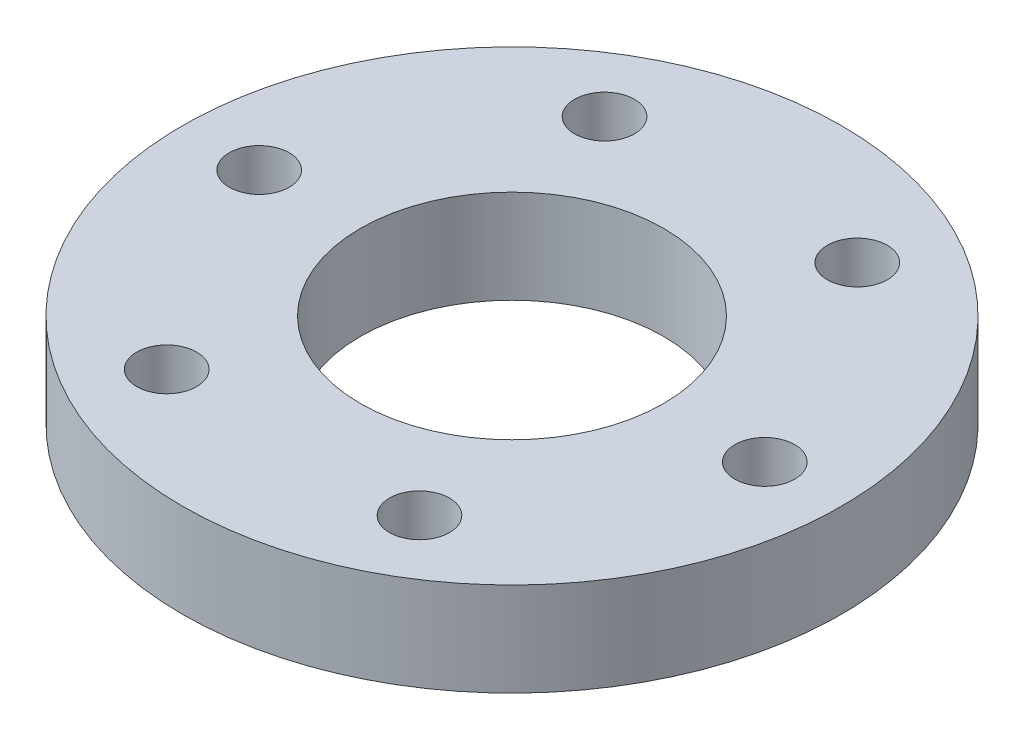
from build123d import *

# Parameters (mm, degrees)
SKETCH1_R            = 17.6
SKETCH1_R_2          = 8.1
BOSS_EXTRUDE1_DEPTH  = 5
CUT_EXTRUDE1_DEPTH   = 2.6
M3_CLEARANCE_HOLE1_D = 3.2
CIRPATTERN1_COUNT    = 6


with BuildPart() as part:
    # Sketch1 → Boss-Extrude1 (new body)
    with BuildSketch(Plane(origin=(0, 0, 0), x_dir=(1, 0, 0), z_dir=(0, 1, 0))):
        with Locations(Location((0, 0, 0), (0, 0, 270))):
            Circle(SKETCH1_R)
        with Locations(Location((0, 0, 0), (0, 0, 270))):
            Circle(SKETCH1_R_2, mode=Mode.SUBTRACT)
    extrude(amount=BOSS_EXTRUDE1_DEPTH)

    # Sketch2 → Cut-Extrude1 (cut)
    with BuildSketch(Plane.XZ):
        Polygon((13.5, 3.233161507), (10.7, 1.616580754), (10.7, -1.616580754), (13.5, -3.233161507), (16.3, -1.616580754), (16.3, 1.616580754), align=None)
    cut_extrude1 = extrude(amount=-CUT_EXTRUDE1_DEPTH, mode=Mode.SUBTRACT)

    # M3 Clearance Hole1 (through all)
    with Locations(Plane(origin=(0, 2.6, 0), x_dir=(-1, 0, 0), z_dir=(0, -1, 0))):
        with Locations((-13.5, 0)):
            m3_clearance_hole1 = Hole(M3_CLEARANCE_HOLE1_D / 2)

    # CirPattern1: Cut-Extrude1, M3 Clearance Hole1 ×6 about axis
    cirpattern1_axis = Axis((0, 0, 0), (0, 1, 0))
    add([cut_extrude1.rotate(cirpattern1_axis, i * 360 / CIRPATTERN1_COUNT) for i in range(1, CIRPATTERN1_COUNT)], mode=Mode.SUBTRACT)
    add([m3_clearance_hole1.rotate(cirpattern1_axis, i * 360 / CIRPATTERN1_COUNT) for i in range(1, CIRPATTERN1_COUNT)], mode=Mode.SUBTRACT)


solid = part.part
